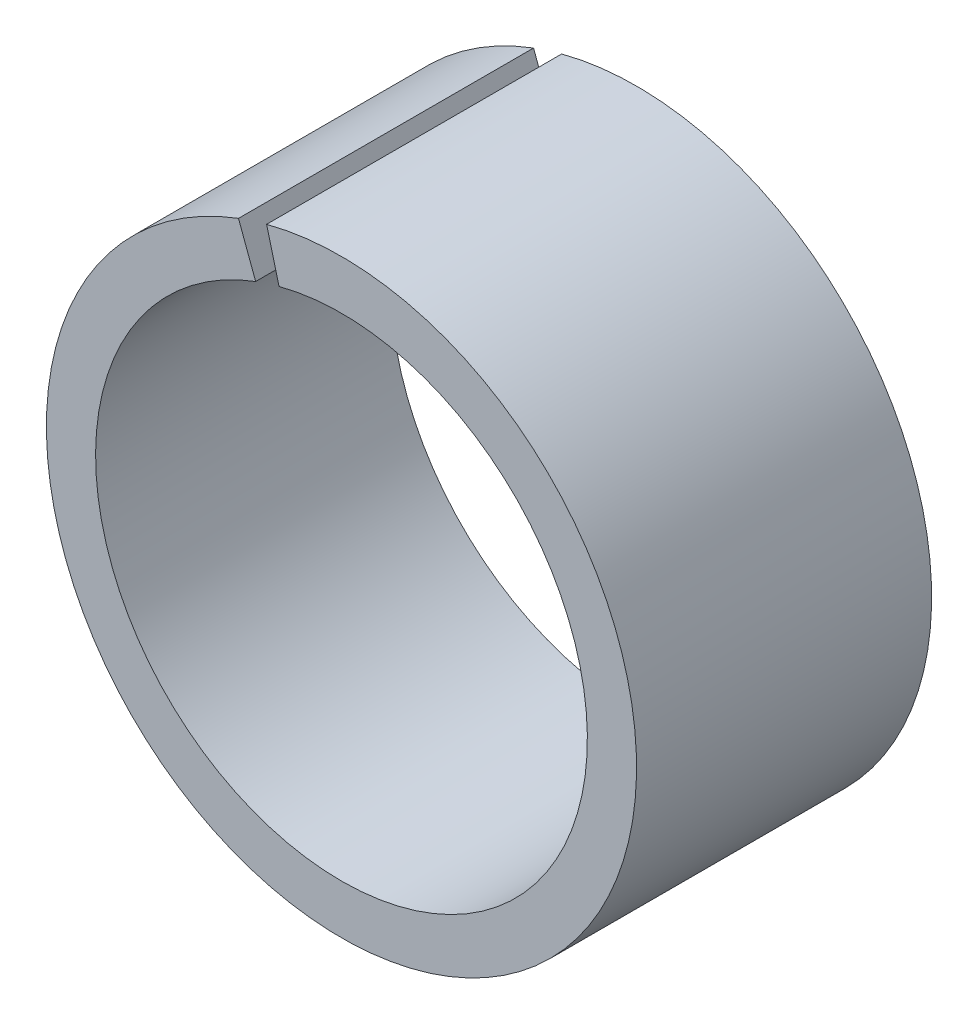
from build123d import *

# Parameters (mm, degrees)
SKETCH_1_R          = 6
SKETCH_1_R_2        = 5
EXTRUDE_1_DEPTH     = 6
CUT_EXTRUDE_1_DEPTH = 10


with BuildPart() as part:
    # 草图1 → 凸台-拉伸1 (new body)
    with BuildSketch(Plane.XY):
        Circle(SKETCH_1_R)
        Circle(SKETCH_1_R_2, mode=Mode.SUBTRACT)
    extrude(amount=EXTRUDE_1_DEPTH)

    # 草图2 → 切除-拉伸1 (cut)
    with BuildSketch(Plane.XY.offset(6)):
        Polygon((0, 0), (-3.579836115, 9.610371215), (-2.615768577, 9.969483648), align=None)
    extrude(amount=-CUT_EXTRUDE_1_DEPTH, mode=Mode.SUBTRACT)


solid = part.part
